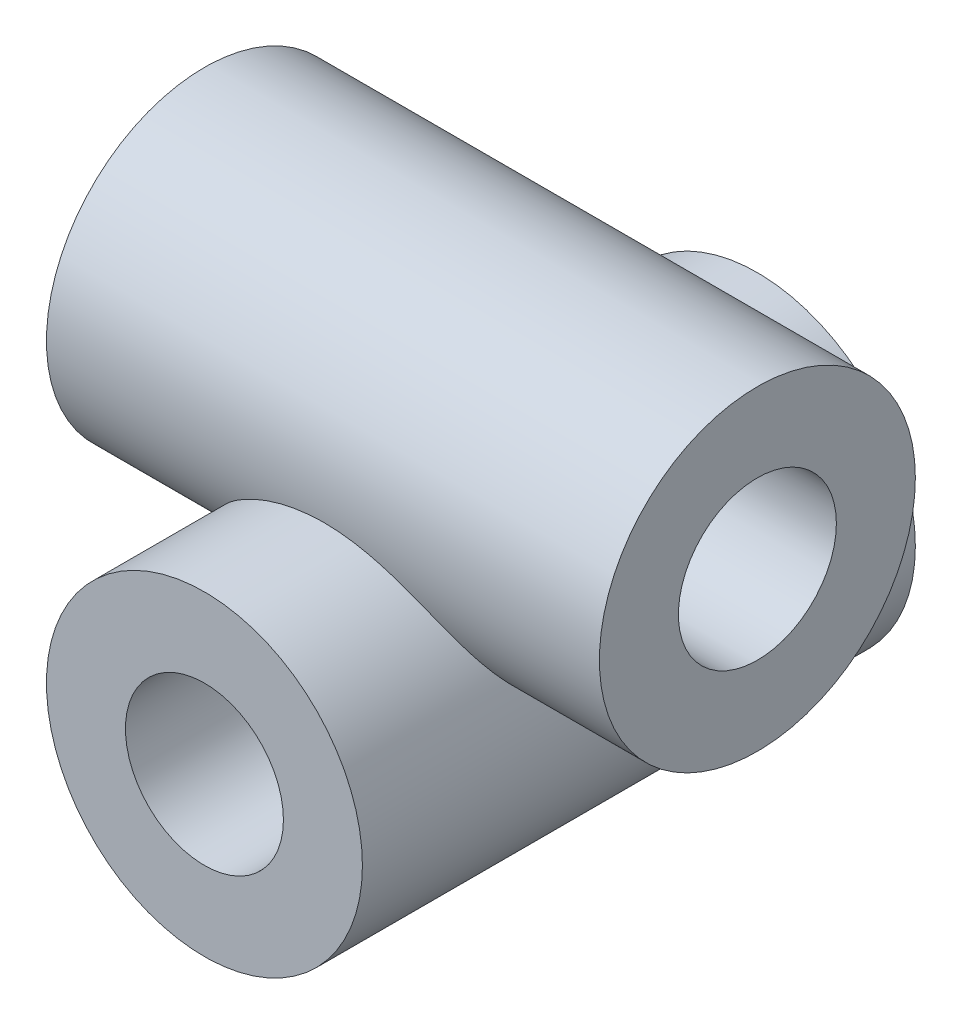
from build123d import *

# Parameters (mm, degrees)
SKETCH2_R           = 16
SKETCH2_R_2         = 8
BOSS_EXTRUDE1_DEPTH = 56
BOSS_EXTRUDE2_DEPTH = 28
SKETCH4_R           = 8
CUT_EXTRUDE1_DEPTH  = 28
SKETCH5_R           = 8
CUT_EXTRUDE2_DEPTH  = 56


with BuildPart() as part:
    # Sketch2 → Boss-Extrude1 (new body)
    with BuildSketch(Plane.XY):
        Circle(SKETCH2_R)
        Circle(SKETCH2_R_2, mode=Mode.SUBTRACT)
    extrude(amount=BOSS_EXTRUDE1_DEPTH)

    # Sketch3 → Boss-Extrude2 (add, symmetric)
    with BuildSketch(Plane(origin=(0, 0, 0), x_dir=(0, 0, -1), z_dir=(1, 0, 0))):
        with BuildLine():
            ThreePointArc((-44, 18), (-28, 2), (-12, 18))
            Line((-12, 18), (-20, 18))
            ThreePointArc((-20, 18), (-28, 10), (-36, 18))
            Line((-36, 18), (-44, 18))
        make_face()
        with BuildLine():
            Line((-20, 18), (-12, 18))
            ThreePointArc((-12, 18), (-28, 34), (-44, 18))
            Line((-44, 18), (-36, 18))
            ThreePointArc((-36, 18), (-28, 26), (-20, 18))
        make_face()
        with BuildLine():
            ThreePointArc((-44, 18), (-28, 2), (-12, 18))
            Line((-12, 18), (-20, 18))
            ThreePointArc((-20, 18), (-28, 10), (-36, 18))
            Line((-36, 18), (-44, 18))
        make_face()
        with BuildLine():
            Line((-20, 18), (-12, 18))
            ThreePointArc((-12, 18), (-28, 34), (-44, 18))
            Line((-44, 18), (-36, 18))
            ThreePointArc((-36, 18), (-28, 26), (-20, 18))
        make_face()
    extrude(amount=BOSS_EXTRUDE2_DEPTH, both=True)

    # Sketch4 → Cut-Extrude1 (cut, symmetric)
    with BuildSketch(Plane(origin=(0, 0, 0), x_dir=(0, 0, -1), z_dir=(1, 0, 0))):
        with Locations((-28, 18)):
            Circle(SKETCH4_R)
    extrude(amount=CUT_EXTRUDE1_DEPTH, both=True, mode=Mode.SUBTRACT)

    # Sketch5 → Cut-Extrude2 (cut)
    with BuildSketch(Plane.XY):
        Circle(SKETCH5_R)
    extrude(amount=CUT_EXTRUDE2_DEPTH, mode=Mode.SUBTRACT)


solid = part.part
